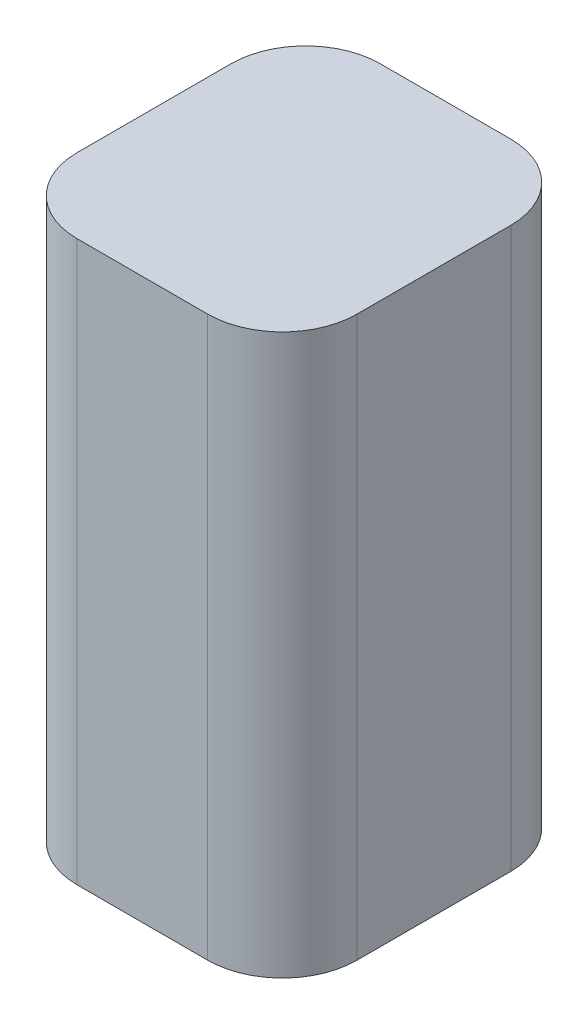
from build123d import *

# Parameters (mm, degrees)
BOSS_EXTRUDE1_DEPTH = 3048


with BuildPart() as part:
    # Sketch1 → Boss-Extrude1 (new body)
    with BuildSketch(Plane(origin=(0, 0, 0), x_dir=(1, 0, 0), z_dir=(0, 1, 0))):
        with BuildLine():
            Line((-355.6, -825.5), (355.6, -825.5))
            ThreePointArc((355.6, -825.5), (642.968195874, -706.468195874), (762, -419.1))
            Line((762, -419.1), (762, 419.1))
            ThreePointArc((762, 419.1), (642.968195874, 706.468195874), (355.6, 825.5))
            Line((355.6, 825.5), (-355.6, 825.5))
            ThreePointArc((-355.6, 825.5), (-642.968195874, 706.468195874), (-762, 419.1))
            Line((-762, 419.1), (-762, -419.1))
            ThreePointArc((-762, -419.1), (-642.968195874, -706.468195874), (-355.6, -825.5))
        make_face()
    extrude(amount=BOSS_EXTRUDE1_DEPTH)


solid = part.part
